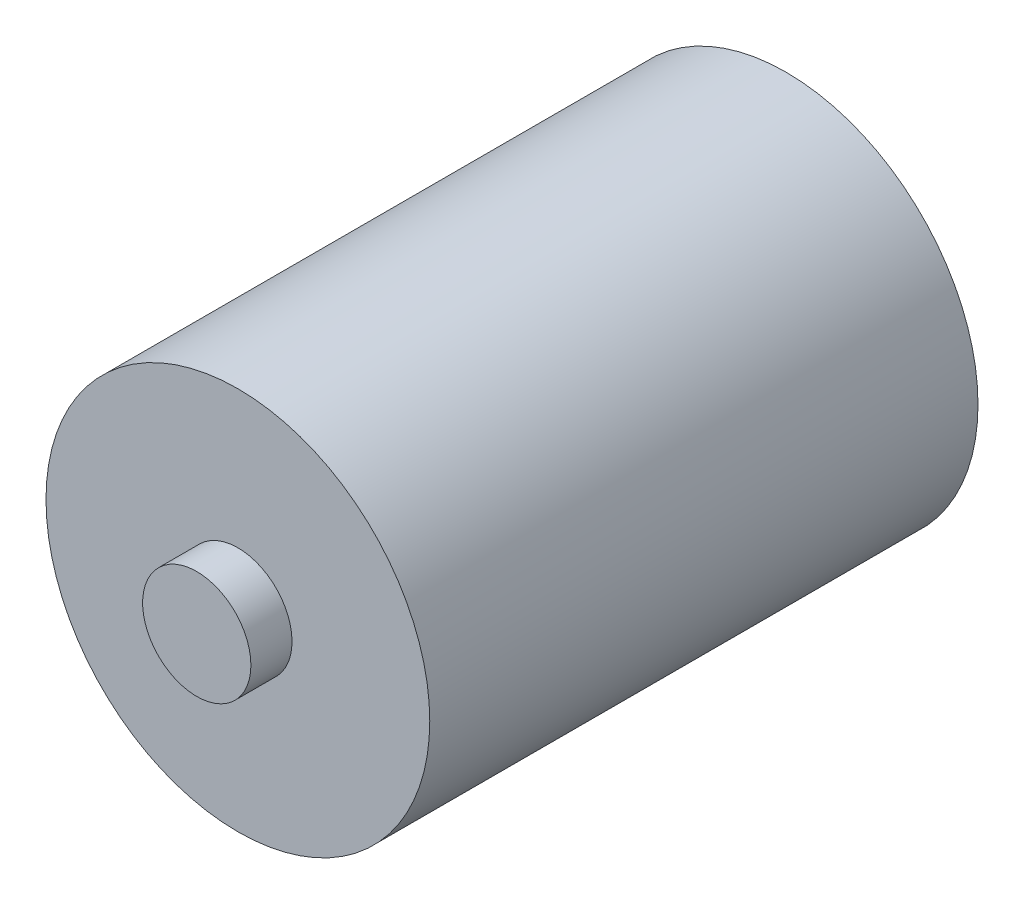
from build123d import *

# Parameters (mm, degrees)
SKETCH3_R           = 70
BOSS_EXTRUDE1_DEPTH = 200
SKETCH4_R           = 19.75
BOSS_EXTRUDE2_DEPTH = 15
SKETCH5_R           = 31.5
BOSS_EXTRUDE3_DEPTH = 7
SKETCH6_R           = 13.005945397
SKETCH6_R_2         = 5.913103463
BOSS_EXTRUDE4_DEPTH = 10


with BuildPart() as part:
    # Sketch3 → Boss-Extrude1 (new body)
    with BuildSketch(Plane.XY):
        Circle(SKETCH3_R)
    extrude(amount=BOSS_EXTRUDE1_DEPTH)

    # Sketch4 → Boss-Extrude2 (add)
    with BuildSketch(Plane.XY.offset(200)):
        Circle(SKETCH4_R)
    extrude(amount=BOSS_EXTRUDE2_DEPTH)

    # Sketch5 → Boss-Extrude3 (add)
    with BuildSketch(Plane(origin=(0, 0, 0), x_dir=(-1, 0, 0), z_dir=(0, 0, -1))):
        with Locations(Location((0, 0, 0), (0, 0, 180))):
            Circle(SKETCH5_R)
    extrude(amount=BOSS_EXTRUDE3_DEPTH)

    # Sketch6 → Boss-Extrude4 (add)
    with BuildSketch(Plane(origin=(0, 0, -7), x_dir=(-1, 0, 0), z_dir=(0, 0, -1))):
        with Locations((8.337101301, 8.580168456)):
            Circle(SKETCH6_R)
        with Locations((-13.657956127, -10.615712672)):
            Circle(SKETCH6_R_2)
    extrude(amount=BOSS_EXTRUDE4_DEPTH)


solid = part.part
